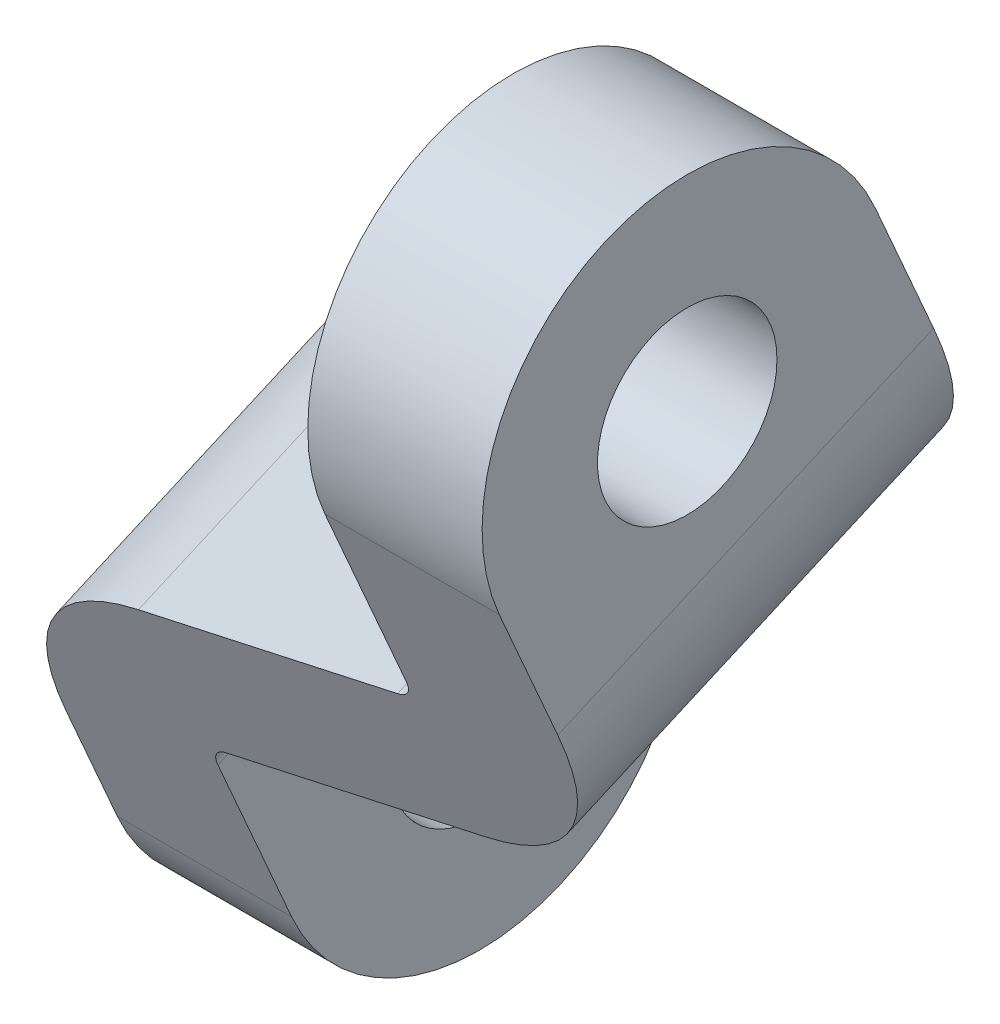
from build123d import *

# Parameters (mm, degrees)
BOSS_EXTRUDE1_DEPTH = 13
SKETCH2_W           = 9.6
SKETCH2_H           = 12.263448081
CUT_EXTRUDE1_DEPTH  = 94.999820378
DRAFT1_ANGLE        = 20
CUT_EXTRUDE2_DEPTH  = 94.999820378
HOLE1_D             = 3.5
HOLE2_D             = 3.5
FILLET1_R           = 0.6
FILLET2_R           = 5


with BuildPart() as part:
    # Sketch1 → Boss-Extrude1 (new body)
    with BuildSketch(Plane(origin=(-37.346370889, 0, 0), x_dir=(0, -1, 0), z_dir=(-1, 0, 0))):
        with BuildLine():
            Line((51.136566376, -50.11421745), (63.813413447, -55.66421745))
            ThreePointArc((63.813413447, -55.66421745), (69.081847366, -53.604216469), (67.021846385, -48.33578255))
            Line((67.021846385, -48.33578255), (54.344999314, -42.78578255))
            ThreePointArc((54.344999314, -42.78578255), (49.076565395, -44.845783531), (51.136566376, -50.11421745))
        make_face()
    extrude(amount=-BOSS_EXTRUDE1_DEPTH)

    # Sketch2 → Cut-Extrude1 (cut, through all)
    with BuildSketch(Plane(origin=(0, 6.977867205, -15.938262243), x_dir=(1, 0, 0), z_dir=(0, -0.4010541172489907, 0.9160543624903671))):
        with Locations((-32.546370889, -68.673916916)):
            Rectangle(SKETCH2_W, SKETCH2_H)
    extrude(amount=-CUT_EXTRUDE1_DEPTH, mode=Mode.SUBTRACT)

    # Draft1
    draft1_faces = [part.faces().sort_by_distance(p)[0] for p in [
        (-32.546370889, -59.943950062, -49.603589992),
    ]]
    draft(draft1_faces, Plane(origin=(-37.346370889, -52.740782845, -46.45), x_dir=(0, -1, 0), z_dir=(-1, 0, 0)), DRAFT1_ANGLE)

    # Sketch3 → Cut-Extrude2 (cut, through all)
    with BuildSketch(Plane(origin=(0, 6.977867205, -15.938262243), x_dir=(1, 0, 0), z_dir=(0, -0.4010541172489907, 0.9160543624903671))):
        Polygon((-18.270337706, -85.869129535), (-18.270337706, -71.075309896), (-33.946370889, -76.780919366), (-33.946370889, -85.869129535), align=None)
    extrude(amount=-CUT_EXTRUDE2_DEPTH, mode=Mode.SUBTRACT)

    # Hole1 (through all)
    with Locations(Plane.ZY.offset(37.346370889)):
        with Locations((-52, -65.417629916)):
            Hole(HOLE1_D / 2)

    # Hole2 (through all)
    with Locations(Plane(origin=(-24.346370889, 0, 0), x_dir=(0, 0, -1), z_dir=(1, 0, 0))):
        with Locations((46.45, -52.740782845)):
            Hole(HOLE2_D / 2)

    # Fillet1
    fillet1_edges = [part.edges().sort_by_distance(p)[0] for p in [
        (-27.746370889, -56.743151462, -48.202261087),
        (-33.946370889, -61.753412466, -50.395783531),
    ]]
    fillet(fillet1_edges, radius=FILLET1_R)

    # Fillet2
    fillet2_edges = [part.edges().sort_by_distance(p)[0] for p in [
        (-37.346370889, -59.943950062, -49.603589992),
        (-24.346370889, -58.552613866, -48.994454625),
    ]]
    fillet(fillet2_edges, radius=FILLET2_R)


solid = part.part
